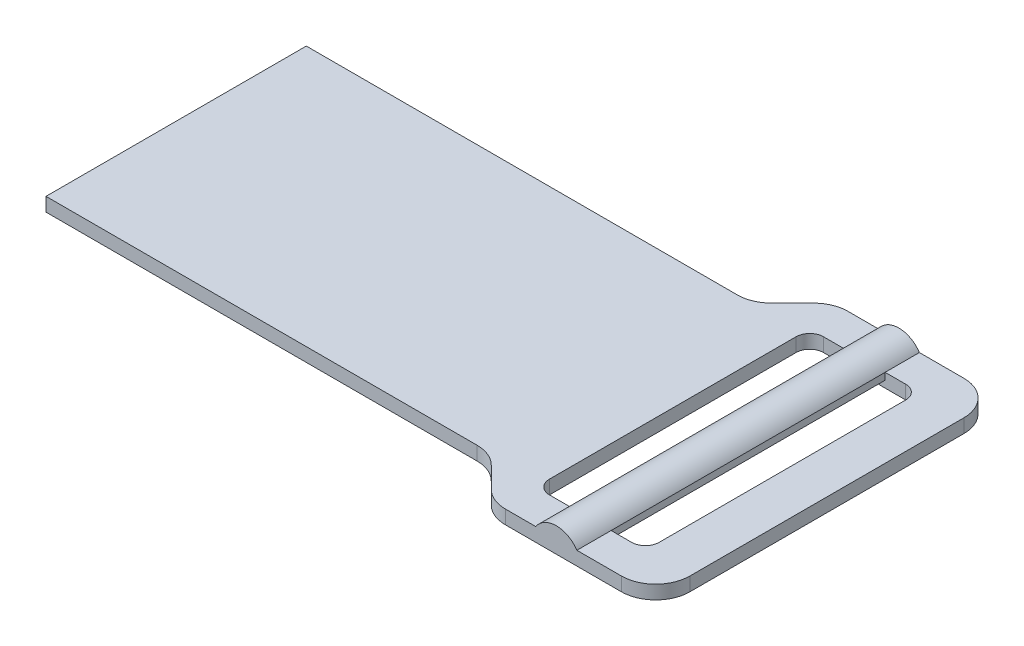
from build123d import *

# Parameters (mm, degrees)
SKETCH1_W           = 16
SKETCH1_H           = 40
BOSS_EXTRUDE1_DEPTH = 2
FILLET1_R           = 5
FILLET2_R           = 2
BOSS_EXTRUDE2_DEPTH = 25


with BuildPart() as part:
    # Sketch1 → Boss-Extrude1 (new body)
    with BuildSketch(Plane(origin=(0, 0, 0), x_dir=(1, 0, 0), z_dir=(0, 1, 0))):
        Polygon((32.5, -19), (38.5, -25), (62.5, -25), (62.5, 25), (38.5, 25), (32.5, 19), (-32.5, 19), (-32.5, -19), align=None)
        with Locations((48, 0)):
            Rectangle(SKETCH1_W, SKETCH1_H, mode=Mode.SUBTRACT)
    extrude(amount=BOSS_EXTRUDE1_DEPTH)

    # Fillet1
    fillet1_edges = [part.edges().sort_by_distance(p)[0] for p in [
        (32.5, 1, -19),
        (38.5, 1, -25),
        (62.5, 1, -25),
        (62.5, 1, 25),
        (38.5, 1, 25),
        (32.5, 1, 19),
    ]]
    fillet(fillet1_edges, radius=FILLET1_R)

    # Fillet2
    fillet2_edges = [part.edges().sort_by_distance(p)[0] for p in [
        (40, 1, -20),
        (40, 1, 20),
        (56, 1, 20),
        (56, 1, -20),
    ]]
    fillet(fillet2_edges, radius=FILLET2_R)

    # Sketch2 → Boss-Extrude2 (add, symmetric)
    with BuildSketch(Plane.XY):
        with BuildLine():
            Line((46, 0), (50, 0))
            Line((50, 0), (51, 1))
            Line((51, 1), (51, 2))
            ThreePointArc((51, 2), (48, 3.605551275), (45, 2))
            Line((45, 2), (45, 1))
            Line((45, 1), (46, 0))
        make_face()
    extrude(amount=BOSS_EXTRUDE2_DEPTH, both=True)


solid = part.part
